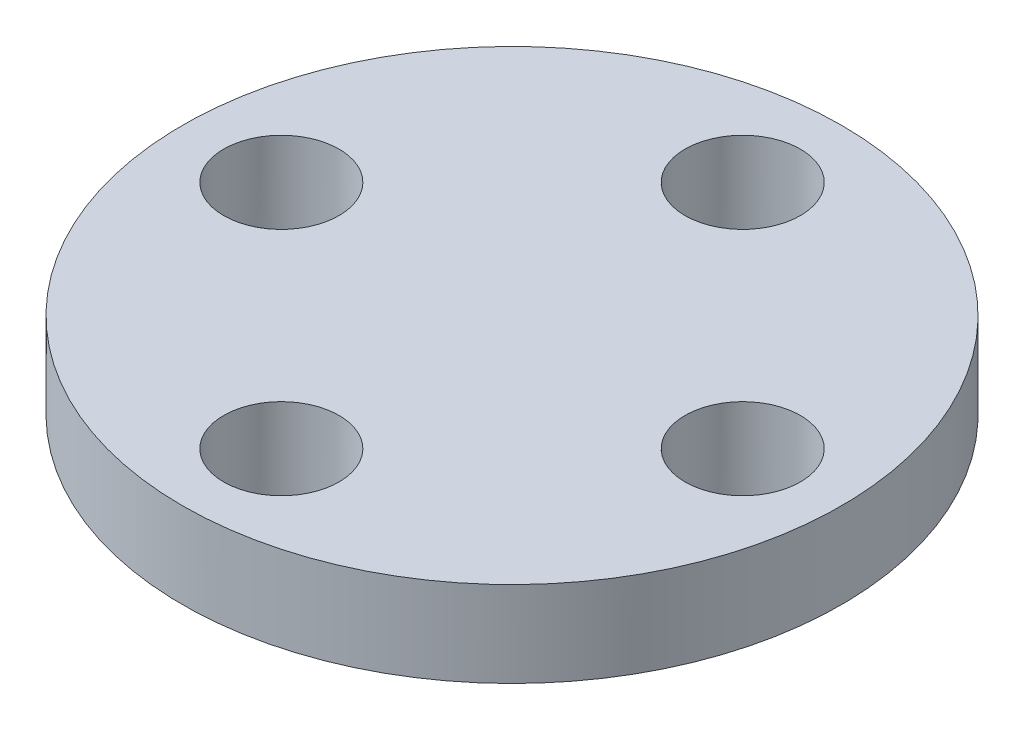
from build123d import *

# Parameters (mm, degrees)
SKETCH1_R           = 10
BOSS_EXTRUDE1_DEPTH = 4.5
SKETCH2_R           = 10
SKETCH2_R_2         = 4.4
SKETCH2_R_3         = 2.75
CUT_EXTRUDE1_DEPTH  = 1.9
SKETCH4_R           = 1.75
CUT_EXTRUDE2_DEPTH  = 15.84082208
SKETCH5_R           = 2.75
CUT_EXTRUDE3_DEPTH  = 1


with BuildPart() as part:
    # Sketch1 → Boss-Extrude1 (new body)
    with BuildSketch(Plane(origin=(0, 0, 0), x_dir=(1, 0, 0), z_dir=(0, 1, 0))):
        with Locations(Location((0, 0, 0), (0, 0, 270))):
            Circle(SKETCH1_R)
    extrude(amount=BOSS_EXTRUDE1_DEPTH)

    # Sketch2 → Cut-Extrude1 (cut)
    # profile 1 of 2: a face of its own
    with BuildSketch(Plane.XZ):
        with Locations(Location((0, 0, 0), (0, 0, 270))):
            Circle(SKETCH2_R)
        with Locations(Location((0, 0, 0), (0, 0, 270))):
            Circle(SKETCH2_R_2, mode=Mode.SUBTRACT)
    # profile 2 of 2: a face of its own
    with BuildSketch(Plane.XZ):
        with Locations(Location((0, 0, 0), (0, 0, 270))):
            Circle(SKETCH2_R_3)
    extrude(amount=-CUT_EXTRUDE1_DEPTH, mode=Mode.SUBTRACT)

    # Sketch4 → Cut-Extrude2 (cut, through all)
    with BuildSketch(Plane(origin=(0, 4.5, 0), x_dir=(1, 0, 0), z_dir=(0, 1, 0))):
        with Locations(Location((0, 7, 0), (0, 0, 270))):
            Circle(SKETCH4_R)
        with Locations(Location((7, 0, 0), (0, 0, 270))):
            Circle(SKETCH4_R)
        with Locations(Location((0, -7, 0), (0, 0, 270))):
            Circle(SKETCH4_R)
        with Locations(Location((-7, 0, 0), (0, 0, 270))):
            Circle(SKETCH4_R)
    extrude(amount=-CUT_EXTRUDE2_DEPTH, mode=Mode.SUBTRACT)

    # Sketch5 → Cut-Extrude3 (cut)
    with BuildSketch(Plane.XZ.offset(-1.9)):
        with Locations(Location((0, 0, 0), (0, 0, 270))):
            Circle(SKETCH5_R)
    extrude(amount=-CUT_EXTRUDE3_DEPTH, mode=Mode.SUBTRACT)


solid = part.part
